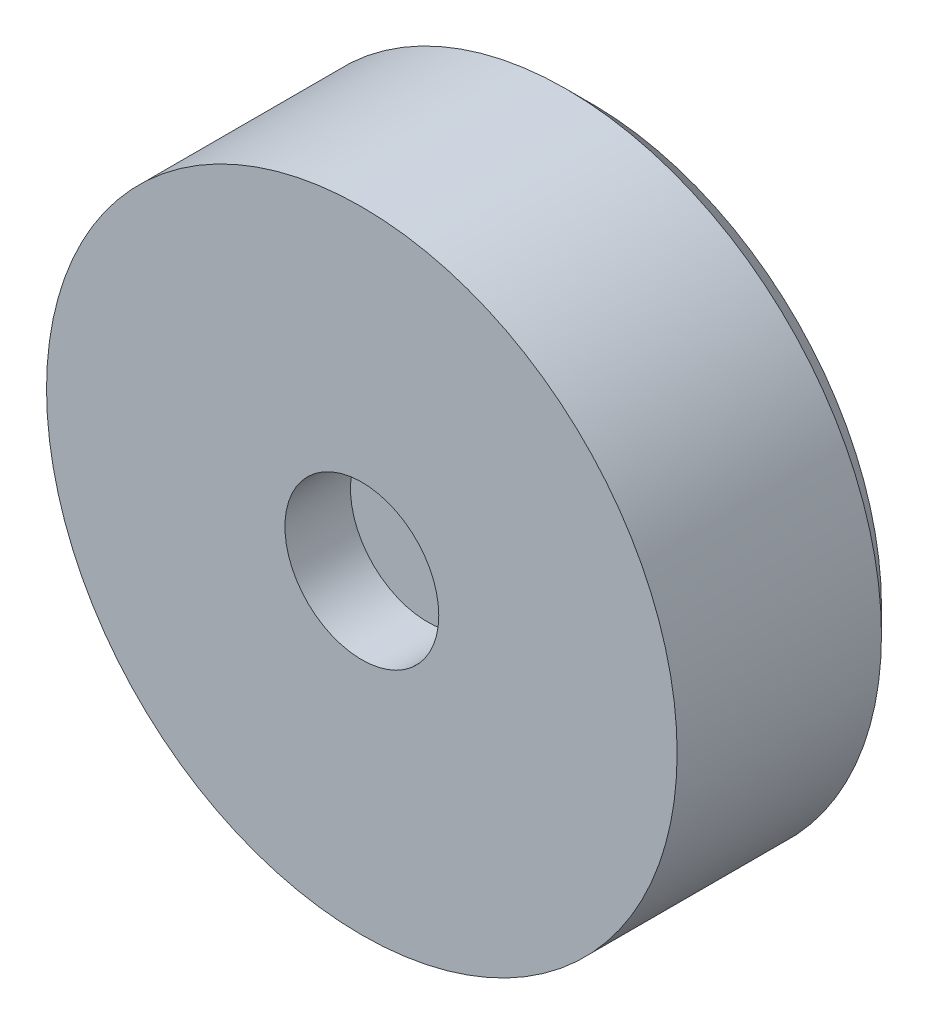
from build123d import *

# Parameters (mm, degrees)
ESQUISSE1_R        = 12.5
BOSS_EXTRU_1_DEPTH = 2.5
ESQUISSE2_R        = 12.5
BOSS_EXTRU_2_DEPTH = 4
ESQUISSE3_R        = 1
BOSS_EXTRU_3_DEPTH = 2
CHANFREIN1_SIZE    = 1
ESQUISSE4_R        = 12.5
ESQUISSE4_R_2      = 3.05
BOSS_EXTRU_4_DEPTH = 2.6


with BuildPart() as part:
    # Esquisse1 → Boss.-Extru.1 (new body)
    with BuildSketch(Plane.XY):
        Circle(ESQUISSE1_R)
        Polygon((-4.936344802, -8.55), (4.936344802, -8.55), (9.872689603, 0), (4.936344802, 8.55), (-4.936344802, 8.55), (-9.872689603, 0), align=None, mode=Mode.SUBTRACT)
    extrude(amount=BOSS_EXTRU_1_DEPTH)

    # Esquisse2 → Boss.-Extru.2 (add)
    with BuildSketch(Plane.XY.offset(2.5)):
        Circle(ESQUISSE2_R)
    extrude(amount=BOSS_EXTRU_2_DEPTH)

    # Esquisse3 → Boss.-Extru.3 (add)
    with BuildSketch(Plane(origin=(0, 0, 2.5), x_dir=(-1, 0, 0), z_dir=(0, 0, -1))):
        with Locations(Location((0, 0, 0), (0, 0, 180))):
            Circle(ESQUISSE3_R)
    extrude(amount=BOSS_EXTRU_3_DEPTH)

    # Chanfrein1
    chanfrein1_edges = [part.edges().sort_by_distance(p)[0] for p in [
        (-12.5, 0, 0),
    ]]
    chamfer(chanfrein1_edges, length=CHANFREIN1_SIZE)

    # Esquisse4 → Boss.-Extru.4 (add)
    with BuildSketch(Plane.XY.offset(6.5)):
        Circle(ESQUISSE4_R)
        Circle(ESQUISSE4_R_2, mode=Mode.SUBTRACT)
    extrude(amount=BOSS_EXTRU_4_DEPTH)


solid = part.part
